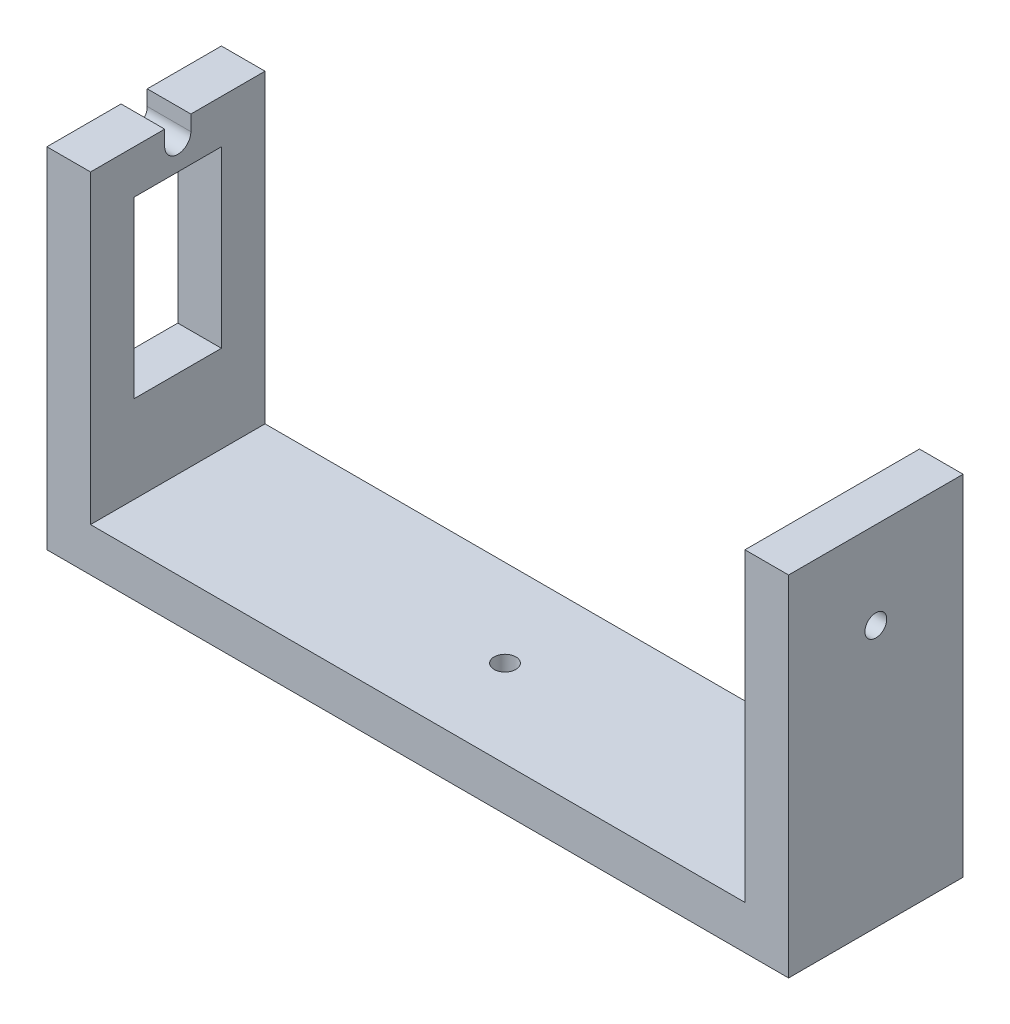
from build123d import *

# Parameters (mm, degrees)
SKETCH1_W           = 170
SKETCH1_H           = 40
SKETCH1_R           = 2.5
BOSS_EXTRUDE1_DEPTH = 10
SKETCH2_W           = 10
SKETCH2_H           = 40
BOSS_EXTRUDE2_DEPTH = 70
SKETCH3_W           = 20
SKETCH3_H           = 40
CUT_EXTRUDE1_DEPTH  = 50
SKETCH4_R           = 2.5
CUT_EXTRUDE2_DEPTH  = 24


with BuildPart() as part:
    # Sketch1 → Boss-Extrude1 (new body)
    with BuildSketch(Plane(origin=(0, 0, 0), x_dir=(1, 0, 0), z_dir=(0, 1, 0))):
        Rectangle(SKETCH1_W, SKETCH1_H)
        with Locations(Location((0, 0, 0), (0, 0, 270))):
            Circle(SKETCH1_R, mode=Mode.SUBTRACT)
    extrude(amount=BOSS_EXTRUDE1_DEPTH)

    # Sketch2 → Boss-Extrude2 (add)
    with BuildSketch(Plane(origin=(0, 10, 0), x_dir=(1, 0, 0), z_dir=(0, 1, 0))):
        with Locations((80, 0)):
            Rectangle(SKETCH2_W, SKETCH2_H)
        with Locations((-80, 0)):
            Rectangle(SKETCH2_W, SKETCH2_H)
    extrude(amount=BOSS_EXTRUDE2_DEPTH)

    # Sketch3 → Cut-Extrude1 (cut)
    with BuildSketch(Plane.ZY.offset(85)):
        with Locations((0, 50)):
            Rectangle(SKETCH3_W, SKETCH3_H)
        with BuildLine():
            Line((3, 80), (3, 76.5))
            ThreePointArc((3, 76.5), (0, 73.5), (-3, 76.5))
            Line((-3, 76.5), (-3, 80))
            ThreePointArc((-3, 80), (0, 83), (3, 80))
        make_face()
    extrude(amount=-CUT_EXTRUDE1_DEPTH, mode=Mode.SUBTRACT)

    # Sketch4 → Cut-Extrude2 (cut)
    with BuildSketch(Plane(origin=(85, 0, 0), x_dir=(0, 0, -1), z_dir=(1, 0, 0))):
        with Locations((0, 60)):
            Circle(SKETCH4_R)
    extrude(amount=-CUT_EXTRUDE2_DEPTH, mode=Mode.SUBTRACT)


solid = part.part
